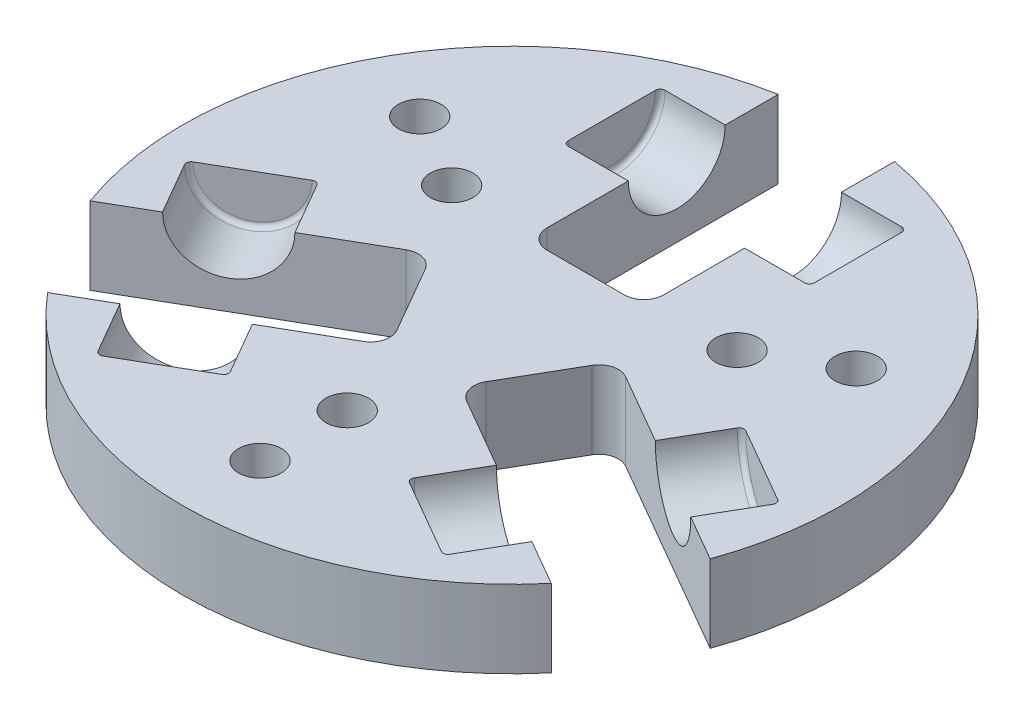
from build123d import *

# Parameters (mm, degrees)
SKETCH1_R                  = 17
BOSS_EXTRUDE1_DEPTH        = 8
SKETCH9_W                  = 6
SKETCH9_H                  = 13.19
CUT_EXTRUDE1_DEPTH         = 26.337718919
SKETCH10_R                 = 2.5
CUT_EXTRUDE2_DEPTH         = 6.35
FILLET2_R                  = 1
CIRPATTERN2_COUNT          = 3
FILLET2_OF_CIRPATTERN2_R   = 1
SKETCH12_R                 = 20
CUT_EXTRUDE3_DEPTH         = 10
F_2_2_2_2_DIAMETER_HOLE1_D = 2.2
FILLET3_R                  = 0.25


with BuildPart() as part:
    # Sketch1 → Boss-Extrude1 (new body)
    with BuildSketch(Plane(origin=(0, 0, 0), x_dir=(1, 0, 0), z_dir=(0, 1, 0))):
        Circle(SKETCH1_R)
    extrude(amount=BOSS_EXTRUDE1_DEPTH)

    # Sketch9 → Cut-Extrude1 (cut, through all)
    with BuildSketch(Plane(origin=(0, 8, 0), x_dir=(1, 0, 0), z_dir=(0, 1, 0))):
        with Locations((0, 10.405)):
            Rectangle(SKETCH9_W, SKETCH9_H)
    cut_extrude1 = extrude(amount=-CUT_EXTRUDE1_DEPTH, mode=Mode.SUBTRACT)

    # Sketch10 → Cut-Extrude2 (cut, symmetric)
    with BuildSketch(Plane(origin=(0, 0, 0), x_dir=(0, 0, -1), z_dir=(1, 0, 0))):
        with Locations((11.5, 4)):
            Circle(SKETCH10_R)
    cut_extrude2 = extrude(amount=CUT_EXTRUDE2_DEPTH, both=True, mode=Mode.SUBTRACT)

    # Fillet2
    fillet2_edges = [part.edges().sort_by_distance(p)[0] for p in [
        (3, 4, -3.81),
        (-3, 4, -3.81),
    ]]
    fillet(fillet2_edges, radius=FILLET2_R)

    # CirPattern2: Cut-Extrude1, Cut-Extrude2 ×3 about axis
    cirpattern2_axis = Axis((0, 40.005, 0), (0, -1, 0))
    add([cut_extrude1.rotate(cirpattern2_axis, i * 360 / CIRPATTERN2_COUNT) for i in range(1, CIRPATTERN2_COUNT)], mode=Mode.SUBTRACT)
    add([cut_extrude2.rotate(cirpattern2_axis, i * 360 / CIRPATTERN2_COUNT) for i in range(1, CIRPATTERN2_COUNT)], mode=Mode.SUBTRACT)

    # Fillet2 of CirPattern2
    fillet2_of_cirpattern2_edges = [part.edges().sort_by_distance(p)[0] for p in [
        (1.799556788, 4, 4.503076211),
        (4.799556788, 4, -0.693076211),
        (-4.799556788, 4, -0.693076211),
        (-1.799556788, 4, 4.503076211),
    ]]
    fillet(fillet2_of_cirpattern2_edges, radius=FILLET2_OF_CIRPATTERN2_R)

    # Sketch12 → Cut-Extrude3 (cut)
    with BuildSketch(Plane(origin=(0, 4, 0), x_dir=(1, 0, 0), z_dir=(0, 1, 0))):
        Circle(SKETCH12_R)
    extrude(amount=CUT_EXTRUDE3_DEPTH, mode=Mode.SUBTRACT)

    # Ø2.2 (2.2) Diameter Hole1 (through all)
    with Locations(Plane.XZ):
        with Locations((-11.258330249, -6.5), (11.258330249, -6.5), (0, 13), (-7.361215932, -4.25), (7.361215932, -4.25), (0, 8.5)):
            Hole(F_2_2_2_2_DIAMETER_HOLE1_D / 2)

    # Fillet3
    fillet3_edges = [part.edges().sort_by_distance(p)[0] for p in [
        (-13.134292144, 1.5, 0.250738686),
        (-6.784292144, 1.5, 11.249261314),
        (6.784292144, 1.5, 11.249261314),
        (13.134292144, 1.5, 0.250738686),
        (-6.35, 1.5, -11.5),
        (6.35, 1.5, -11.5),
    ]]
    fillet(fillet3_edges, radius=FILLET3_R)


solid = part.part
